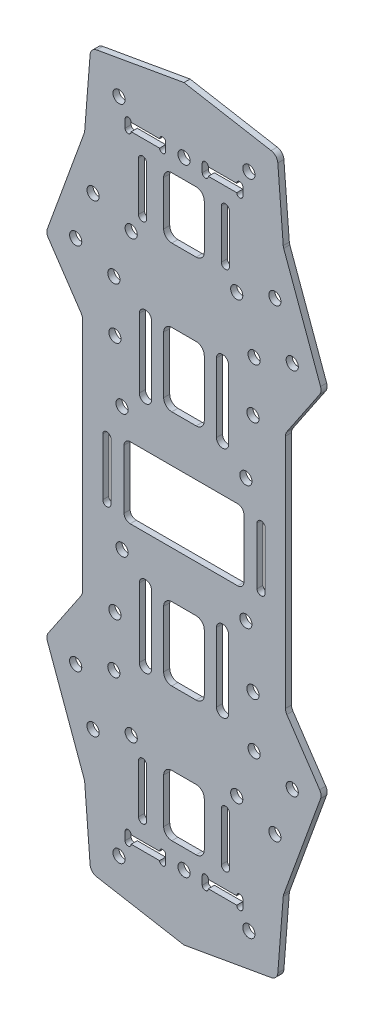
from build123d import *

# Parameters (mm, degrees)
CROQUIS1_R              = 1.5
SALIENTE_EXTRUIR1_DEPTH = 1.5


with BuildPart() as part:
    # Croquis1 → Saliente-Extruir1 (new body)
    with BuildSketch(Plane.XY.offset(1.5)):
        with BuildLine():
            Line((33.651464065, 43.95759461), (24.571418021, 68.904816085))
            ThreePointArc((24.571418021, 68.904816085), (24.49634105, 69.164501027), (24.456968595, 69.43193818))
            Line((24.456968595, 69.43193818), (23.121499045, 86.400687699))
            ThreePointArc((23.121499045, 86.400687699), (22.608100633, 87.588503122), (21.474960733, 88.213385013))
            Line((21.474960733, 88.213385013), (0, 92))
            Line((0, 92), (-21.474960733, 88.213385013))
            ThreePointArc((-21.474960733, 88.213385013), (-22.608100633, 87.588503122), (-23.121499045, 86.400687699))
            Line((-23.121499045, 86.400687699), (-24.456968595, 69.43193818))
            ThreePointArc((-24.456968595, 69.43193818), (-24.49634105, 69.164501027), (-24.571418021, 68.904816085))
            Line((-24.571418021, 68.904816085), (-33.651464065, 43.95759461))
            ThreePointArc((-33.651464065, 43.95759461), (-33.757171127, 43.029815637), (-33.430153969, 42.155168516))
            Line((-33.430153969, 42.155168516), (-25.341924855, 30.163875727))
            ThreePointArc((-25.341924855, 30.163875727), (-25.087390488, 29.63023333), (-25, 29.04548992))
            Line((-25, 29.04548992), (-25, -29.04548992))
            ThreePointArc((-25, -29.04548992), (-25.087390488, -29.63023333), (-25.341924855, -30.163875727))
            Line((-25.341924855, -30.163875727), (-33.430153969, -42.155168516))
            ThreePointArc((-33.430153969, -42.155168516), (-33.757171127, -43.029815637), (-33.651464065, -43.95759461))
            Line((-33.651464065, -43.95759461), (-24.571418021, -68.904816085))
            ThreePointArc((-24.571418021, -68.904816085), (-24.49634105, -69.164501027), (-24.456968595, -69.43193818))
            Line((-24.456968595, -69.43193818), (-23.121499045, -86.400687699))
            ThreePointArc((-23.121499045, -86.400687699), (-22.608100633, -87.588503122), (-21.474960733, -88.213385013))
            Line((-21.474960733, -88.213385013), (0, -92))
            Line((0, -92), (21.474960733, -88.213385013))
            ThreePointArc((21.474960733, -88.213385013), (22.608100633, -87.588503122), (23.121499045, -86.400687699))
            Line((23.121499045, -86.400687699), (24.456968595, -69.43193818))
            ThreePointArc((24.456968595, -69.43193818), (24.49634105, -69.164501027), (24.571418021, -68.904816085))
            Line((24.571418021, -68.904816085), (33.651464065, -43.95759461))
            ThreePointArc((33.651464065, -43.95759461), (33.757171127, -43.029815637), (33.430153969, -42.155168516))
            Line((33.430153969, -42.155168516), (25.341924855, -30.163875727))
            ThreePointArc((25.341924855, -30.163875727), (25.087390488, -29.63023333), (25, -29.04548992))
            Line((25, -29.04548992), (25, 29.04548992))
            ThreePointArc((25, 29.04548992), (25.087390488, 29.63023333), (25.341924855, 30.163875727))
            Line((25.341924855, 30.163875727), (33.430153969, 42.155168516))
            ThreePointArc((33.430153969, 42.155168516), (33.757171127, 43.029815637), (33.651464065, 43.95759461))
        make_face()
        with Locations(Location((16, 81, 0), (0, 0, 180))):
            Circle(CROQUIS1_R, mode=Mode.SUBTRACT)
        with Locations(Location((0, 76, 0), (0, 0, 180))):
            Circle(CROQUIS1_R, mode=Mode.SUBTRACT)
        with Locations(Location((26.672177999, 45.420201433, 0), (0, 0, 180))):
            Circle(CROQUIS1_R, mode=Mode.SUBTRACT)
        with Locations(Location((22.396926208, 57.166359193, 0), (0, 0, 180))):
            Circle(CROQUIS1_R, mode=Mode.SUBTRACT)
        with Locations(Location((17.275251792, 42, 0), (0, 0, 180))):
            Circle(CROQUIS1_R, mode=Mode.SUBTRACT)
        with Locations(Location((13, 53.74615776, 0), (0, 0, 180))):
            Circle(CROQUIS1_R, mode=Mode.SUBTRACT)
        with Locations(Location((17, 29.5, 0), (0, 0, 180))):
            Circle(CROQUIS1_R, mode=Mode.SUBTRACT)
        with Locations(Location((15.25, 15.25, 0), (0, 0, 180))):
            Circle(CROQUIS1_R, mode=Mode.SUBTRACT)
        with Locations(Location((-15.25, 15.25, 0), (0, 0, 180))):
            Circle(CROQUIS1_R, mode=Mode.SUBTRACT)
        with Locations(Location((-17, 29.5, 0), (0, 0, 180))):
            Circle(CROQUIS1_R, mode=Mode.SUBTRACT)
        with Locations(Location((-13, 53.74615776, 0), (0, 0, 180))):
            Circle(CROQUIS1_R, mode=Mode.SUBTRACT)
        with Locations(Location((-17.275251792, 42, 0), (0, 0, 180))):
            Circle(CROQUIS1_R, mode=Mode.SUBTRACT)
        with Locations(Location((-22.396926208, 57.166359193, 0), (0, 0, 180))):
            Circle(CROQUIS1_R, mode=Mode.SUBTRACT)
        with Locations(Location((-26.672177999, 45.420201433, 0), (0, 0, 180))):
            Circle(CROQUIS1_R, mode=Mode.SUBTRACT)
        with Locations(Location((-16, 81, 0), (0, 0, 180))):
            Circle(CROQUIS1_R, mode=Mode.SUBTRACT)
        with Locations(Location((-16, -81, 0), (0, 0, 180))):
            Circle(CROQUIS1_R, mode=Mode.SUBTRACT)
        with Locations(Location((-26.672177999, -45.420201433, 0), (0, 0, 180))):
            Circle(CROQUIS1_R, mode=Mode.SUBTRACT)
        with Locations(Location((-22.396926208, -57.166359193, 0), (0, 0, 180))):
            Circle(CROQUIS1_R, mode=Mode.SUBTRACT)
        with Locations(Location((-17.275251792, -42, 0), (0, 0, 180))):
            Circle(CROQUIS1_R, mode=Mode.SUBTRACT)
        with Locations(Location((-13, -53.74615776, 0), (0, 0, 180))):
            Circle(CROQUIS1_R, mode=Mode.SUBTRACT)
        with Locations(Location((-17, -29.5, 0), (0, 0, 180))):
            Circle(CROQUIS1_R, mode=Mode.SUBTRACT)
        with Locations(Location((-15.25, -15.25, 0), (0, 0, 180))):
            Circle(CROQUIS1_R, mode=Mode.SUBTRACT)
        with Locations(Location((15.25, -15.25, 0), (0, 0, 180))):
            Circle(CROQUIS1_R, mode=Mode.SUBTRACT)
        with Locations(Location((17, -29.5, 0), (0, 0, 180))):
            Circle(CROQUIS1_R, mode=Mode.SUBTRACT)
        with Locations(Location((13, -53.74615776, 0), (0, 0, 180))):
            Circle(CROQUIS1_R, mode=Mode.SUBTRACT)
        with Locations(Location((17.275251792, -42, 0), (0, 0, 180))):
            Circle(CROQUIS1_R, mode=Mode.SUBTRACT)
        with Locations(Location((22.396926208, -57.166359193, 0), (0, 0, 180))):
            Circle(CROQUIS1_R, mode=Mode.SUBTRACT)
        with Locations(Location((26.672177999, -45.420201433, 0), (0, 0, 180))):
            Circle(CROQUIS1_R, mode=Mode.SUBTRACT)
        with Locations(Location((0, -76, 0), (0, 0, 180))):
            Circle(CROQUIS1_R, mode=Mode.SUBTRACT)
        with Locations(Location((16, -81, 0), (0, 0, 180))):
            Circle(CROQUIS1_R, mode=Mode.SUBTRACT)
        with BuildLine():
            Line((-18, 7), (-18, -7))
            ThreePointArc((-18, -7), (-19, -8), (-20, -7))
            Line((-20, -7), (-20, 7))
            ThreePointArc((-20, 7), (-19, 8), (-18, 7))
        make_face(mode=Mode.SUBTRACT)
        with BuildLine():
            Line((9.2, -70.25), (9.2, -58.25))
            ThreePointArc((9.2, -58.25), (10.2, -57.25), (11.2, -58.25))
            Line((11.2, -58.25), (11.2, -70.25))
            ThreePointArc((11.2, -70.25), (10.2, -71.25), (9.2, -70.25))
        make_face(mode=Mode.SUBTRACT)
        with BuildLine():
            Line((-11, -37.25), (-11, -20.25))
            ThreePointArc((-11, -20.25), (-9.5, -18.75), (-8, -20.25))
            Line((-8, -20.25), (-8, -37.25))
            ThreePointArc((-8, -37.25), (-9.5, -38.75), (-11, -37.25))
        make_face(mode=Mode.SUBTRACT)
        with BuildLine():
            Line((-5, -36.25), (-5, -22.25))
            ThreePointArc((-5, -22.25), (-4.414213562, -20.835786438), (-3, -20.25))
            Line((-3, -20.25), (3, -20.25))
            ThreePointArc((3, -20.25), (4.414213562, -20.835786438), (5, -22.25))
            Line((5, -22.25), (5, -36.25))
            ThreePointArc((5, -36.25), (4.414213562, -37.664213562), (3, -38.25))
            Line((3, -38.25), (-3, -38.25))
            ThreePointArc((-3, -38.25), (-4.414213562, -37.664213562), (-5, -36.25))
        make_face(mode=Mode.SUBTRACT)
        with BuildLine():
            Line((-9.2, 70.25), (-9.2, 58.25))
            ThreePointArc((-9.2, 58.25), (-10.2, 57.25), (-11.2, 58.25))
            Line((-11.2, 58.25), (-11.2, 70.25))
            ThreePointArc((-11.2, 70.25), (-10.2, 71.25), (-9.2, 70.25))
        make_face(mode=Mode.SUBTRACT)
        with BuildLine():
            Line((11, 37.25), (11, 20.25))
            ThreePointArc((11, 20.25), (9.5, 18.75), (8, 20.25))
            Line((8, 20.25), (8, 37.25))
            ThreePointArc((8, 37.25), (9.5, 38.75), (11, 37.25))
        make_face(mode=Mode.SUBTRACT)
        with BuildLine():
            Line((14.75, 7.25), (14.75, -7.25))
            ThreePointArc((14.75, -7.25), (14.310660172, -8.310660172), (13.25, -8.75))
            Line((13.25, -8.75), (-13.25, -8.75))
            ThreePointArc((-13.25, -8.75), (-14.310660172, -8.310660172), (-14.75, -7.25))
            Line((-14.75, -7.25), (-14.75, 7.25))
            ThreePointArc((-14.75, 7.25), (-14.310660172, 8.310660172), (-13.25, 8.75))
            Line((-13.25, 8.75), (13.25, 8.75))
            ThreePointArc((13.25, 8.75), (14.310660172, 8.310660172), (14.75, 7.25))
        make_face(mode=Mode.SUBTRACT)
        with BuildLine():
            Line((-5, 22.25), (-5, 36.25))
            ThreePointArc((-5, 36.25), (-4.414213562, 37.664213562), (-3, 38.25))
            Line((-3, 38.25), (3, 38.25))
            ThreePointArc((3, 38.25), (4.414213562, 37.664213562), (5, 36.25))
            Line((5, 36.25), (5, 22.25))
            ThreePointArc((5, 22.25), (4.414213562, 20.835786438), (3, 20.25))
            Line((3, 20.25), (-3, 20.25))
            ThreePointArc((-3, 20.25), (-4.414213562, 20.835786438), (-5, 22.25))
        make_face(mode=Mode.SUBTRACT)
        with BuildLine():
            Line((-3, 71.25), (3, 71.25))
            ThreePointArc((3, 71.25), (4.414213562, 70.664213562), (5, 69.25))
            Line((5, 69.25), (5, 58.25))
            ThreePointArc((5, 58.25), (4.414213562, 56.835786438), (3, 56.25))
            Line((3, 56.25), (-3, 56.25))
            ThreePointArc((-3, 56.25), (-4.414213562, 56.835786438), (-5, 58.25))
            Line((-5, 58.25), (-5, 69.25))
            ThreePointArc((-5, 69.25), (-4.414213562, 70.664213562), (-3, 71.25))
        make_face(mode=Mode.SUBTRACT)
        with BuildLine():
            Line((11.2, 70.25), (11.2, 58.25))
            ThreePointArc((11.2, 58.25), (10.2, 57.25), (9.2, 58.25))
            Line((9.2, 58.25), (9.2, 70.25))
            ThreePointArc((9.2, 70.25), (10.2, 71.25), (11.2, 70.25))
        make_face(mode=Mode.SUBTRACT)
        with BuildLine():
            Line((-8, 37.25), (-8, 20.25))
            ThreePointArc((-8, 20.25), (-9.5, 18.75), (-11, 20.25))
            Line((-11, 20.25), (-11, 37.25))
            ThreePointArc((-11, 37.25), (-9.5, 38.75), (-8, 37.25))
        make_face(mode=Mode.SUBTRACT)
        with BuildLine():
            Line((3, -71.25), (-3, -71.25))
            ThreePointArc((-3, -71.25), (-4.414213562, -70.664213562), (-5, -69.25))
            Line((-5, -69.25), (-5, -58.25))
            ThreePointArc((-5, -58.25), (-4.414213562, -56.835786438), (-3, -56.25))
            Line((-3, -56.25), (3, -56.25))
            ThreePointArc((3, -56.25), (4.414213562, -56.835786438), (5, -58.25))
            Line((5, -58.25), (5, -69.25))
            ThreePointArc((5, -69.25), (4.414213562, -70.664213562), (3, -71.25))
        make_face(mode=Mode.SUBTRACT)
        with BuildLine():
            Line((-11.2, -70.25), (-11.2, -58.25))
            ThreePointArc((-11.2, -58.25), (-10.2, -57.25), (-9.2, -58.25))
            Line((-9.2, -58.25), (-9.2, -70.25))
            ThreePointArc((-9.2, -70.25), (-10.2, -71.25), (-11.2, -70.25))
        make_face(mode=Mode.SUBTRACT)
        with BuildLine():
            Line((8, -37.25), (8, -20.25))
            ThreePointArc((8, -20.25), (9.5, -18.75), (11, -20.25))
            Line((11, -20.25), (11, -37.25))
            ThreePointArc((11, -37.25), (9.5, -38.75), (8, -37.25))
        make_face(mode=Mode.SUBTRACT)
        with BuildLine():
            Line((20, 7), (20, -7))
            ThreePointArc((20, -7), (19, -8), (18, -7))
            Line((18, -7), (18, 7))
            ThreePointArc((18, 7), (19, 8), (20, 7))
        make_face(mode=Mode.SUBTRACT)
        with BuildLine():
            Line((14.5, 77), (14.5, 75))
            ThreePointArc((14.5, 75), (13.75, 74.25), (13, 75))
            Line((13, 75), (6, 75))
            ThreePointArc((6, 75), (5.25, 74.25), (4.5, 75))
            Line((4.5, 75), (4.5, 77))
            ThreePointArc((4.5, 77), (5.25, 77.75), (6, 77))
            Line((6, 77), (13, 77))
            ThreePointArc((13, 77), (13.75, 77.75), (14.5, 77))
        make_face(mode=Mode.SUBTRACT)
        with BuildLine():
            Line((-13, 77), (-6, 77))
            ThreePointArc((-6, 77), (-5.25, 77.75), (-4.5, 77))
            Line((-4.5, 77), (-4.5, 75))
            ThreePointArc((-4.5, 75), (-5.25, 74.25), (-6, 75))
            Line((-6, 75), (-13, 75))
            ThreePointArc((-13, 75), (-13.75, 74.25), (-14.5, 75))
            Line((-14.5, 75), (-14.5, 77))
            ThreePointArc((-14.5, 77), (-13.75, 77.75), (-13, 77))
        make_face(mode=Mode.SUBTRACT)
        with BuildLine():
            Line((-6, -77), (-13, -77))
            ThreePointArc((-13, -77), (-13.75, -77.75), (-14.5, -77))
            Line((-14.5, -77), (-14.5, -75))
            ThreePointArc((-14.5, -75), (-13.75, -74.25), (-13, -75))
            Line((-13, -75), (-6, -75))
            ThreePointArc((-6, -75), (-5.25, -74.25), (-4.5, -75))
            Line((-4.5, -75), (-4.5, -77))
            ThreePointArc((-4.5, -77), (-5.25, -77.75), (-6, -77))
        make_face(mode=Mode.SUBTRACT)
        with BuildLine():
            Line((13, -77), (6, -77))
            ThreePointArc((6, -77), (5.25, -77.75), (4.5, -77))
            Line((4.5, -77), (4.5, -75))
            ThreePointArc((4.5, -75), (5.25, -74.25), (6, -75))
            Line((6, -75), (13, -75))
            ThreePointArc((13, -75), (13.75, -74.25), (14.5, -75))
            Line((14.5, -75), (14.5, -77))
            ThreePointArc((14.5, -77), (13.75, -77.75), (13, -77))
        make_face(mode=Mode.SUBTRACT)
    extrude(amount=-SALIENTE_EXTRUIR1_DEPTH)


solid = part.part
